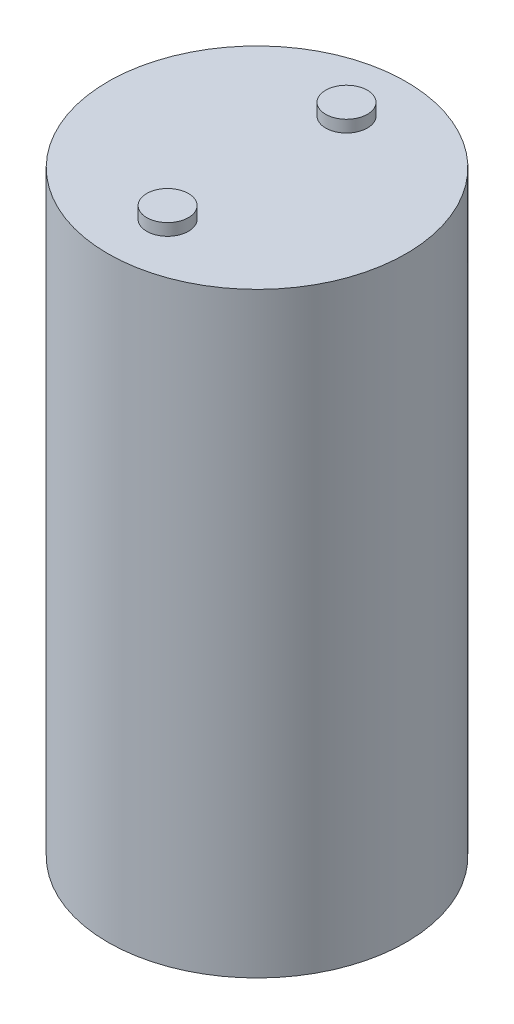
from build123d import *

# Parameters (mm, degrees)
SKETCH1_R           = 12.5
BOSS_EXTRUDE1_DEPTH = 50
SKETCH2_R           = 1.75
BOSS_EXTRUDE2_DEPTH = 1


with BuildPart() as part:
    # Sketch1 → Boss-Extrude1 (new body)
    with BuildSketch(Plane(origin=(0, 0, 0), x_dir=(1, 0, 0), z_dir=(0, 1, 0))):
        with Locations(Location((0, 0, 0), (0, 0, 270))):
            Circle(SKETCH1_R)
    extrude(amount=BOSS_EXTRUDE1_DEPTH)

    # Sketch2 → Boss-Extrude2 (add)
    with BuildSketch(Plane(origin=(0, 50, 0), x_dir=(1, 0, 0), z_dir=(0, 1, 0))):
        with Locations(Location((0, 7.5, 0), (0, 0, 270))):
            Circle(SKETCH2_R)
        with Locations(Location((0, -7.5, 0), (0, 0, 270))):
            Circle(SKETCH2_R)
    extrude(amount=BOSS_EXTRUDE2_DEPTH)


solid = part.part
